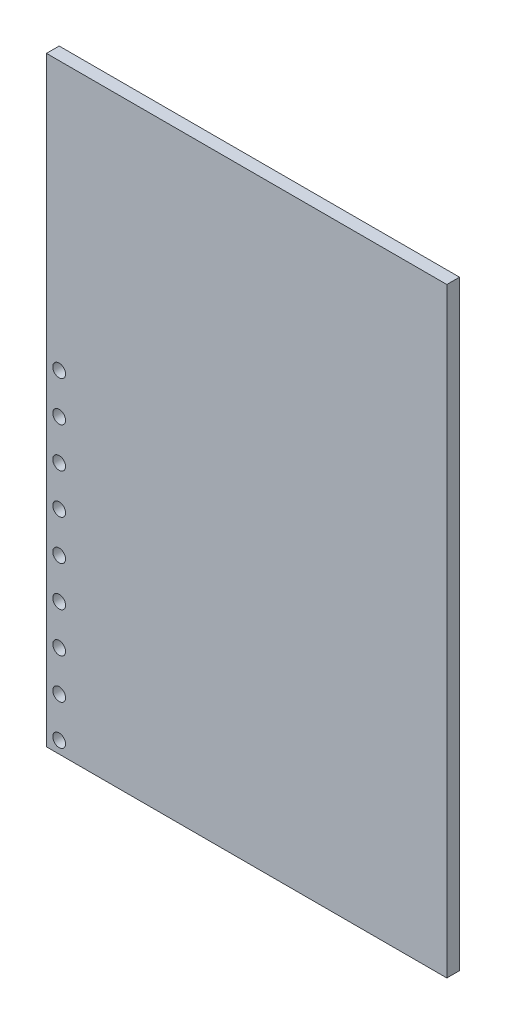
from build123d import *

# Parameters (mm, degrees)
SKETCH1_W           = 100
SKETCH1_H           = 3.175
BOSS_EXTRUDE1_DEPTH = 150
SKETCH2_R           = 1.6
CUT_EXTRUDE2_DEPTH  = 5
SKETCH2_14_R        = 1.6
CUT_EXTRUDE3_DEPTH  = 5
SKETCH2_15_R        = 1.6
CUT_EXTRUDE4_DEPTH  = 5
SKETCH2_16_R        = 1.6
CUT_EXTRUDE5_DEPTH  = 5
SKETCH2_17_R        = 1.6
CUT_EXTRUDE6_DEPTH  = 5
SKETCH2_18_R        = 1.6
CUT_EXTRUDE7_DEPTH  = 5
SKETCH2_19_R        = 1.6
CUT_EXTRUDE8_DEPTH  = 5
SKETCH2_20_R        = 1.6
CUT_EXTRUDE9_DEPTH  = 5
SKETCH2_21_R        = 1.6
CUT_EXTRUDE10_DEPTH = 5


with BuildPart() as part:
    # Sketch1 → Boss-Extrude1 (new body)
    with BuildSketch(Plane(origin=(0, 0, 0), x_dir=(1, 0, 0), z_dir=(0, 1, 0))):
        with Locations((50, 1.5875)):
            Rectangle(SKETCH1_W, SKETCH1_H)
    extrude(amount=BOSS_EXTRUDE1_DEPTH)

    # Sketch2 → Cut-Extrude2 (cut)
    with BuildSketch(Plane.XY):
        with Locations((3.175, 83)):
            Circle(SKETCH2_R)
    extrude(amount=-CUT_EXTRUDE2_DEPTH, mode=Mode.SUBTRACT)

    # Sketch2<14> → Cut-Extrude3 (cut)
    with BuildSketch(Plane.XY):
        with Locations((3.175, 73)):
            Circle(SKETCH2_14_R)
    extrude(amount=-CUT_EXTRUDE3_DEPTH, mode=Mode.SUBTRACT)

    # Sketch2<15> → Cut-Extrude4 (cut)
    with BuildSketch(Plane.XY):
        with Locations((3.175, 53)):
            Circle(SKETCH2_15_R)
    extrude(amount=-CUT_EXTRUDE4_DEPTH, mode=Mode.SUBTRACT)

    # Sketch2<16> → Cut-Extrude5 (cut)
    with BuildSketch(Plane.XY):
        with Locations((3.175, 63)):
            Circle(SKETCH2_16_R)
    extrude(amount=-CUT_EXTRUDE5_DEPTH, mode=Mode.SUBTRACT)

    # Sketch2<17> → Cut-Extrude6 (cut)
    with BuildSketch(Plane.XY):
        with Locations((3.175, 43)):
            Circle(SKETCH2_17_R)
    extrude(amount=-CUT_EXTRUDE6_DEPTH, mode=Mode.SUBTRACT)

    # Sketch2<18> → Cut-Extrude7 (cut)
    with BuildSketch(Plane.XY):
        with Locations((3.175, 33)):
            Circle(SKETCH2_18_R)
    extrude(amount=-CUT_EXTRUDE7_DEPTH, mode=Mode.SUBTRACT)

    # Sketch2<19> → Cut-Extrude8 (cut)
    with BuildSketch(Plane.XY):
        with Locations((3.175, 23)):
            Circle(SKETCH2_19_R)
    extrude(amount=-CUT_EXTRUDE8_DEPTH, mode=Mode.SUBTRACT)

    # Sketch2<20> → Cut-Extrude9 (cut)
    with BuildSketch(Plane.XY):
        with Locations((3.175, 13)):
            Circle(SKETCH2_20_R)
    extrude(amount=-CUT_EXTRUDE9_DEPTH, mode=Mode.SUBTRACT)

    # Sketch2<21> → Cut-Extrude10 (cut)
    with BuildSketch(Plane.XY):
        with Locations((3.175, 3)):
            Circle(SKETCH2_21_R)
    extrude(amount=-CUT_EXTRUDE10_DEPTH, mode=Mode.SUBTRACT)


solid = part.part
